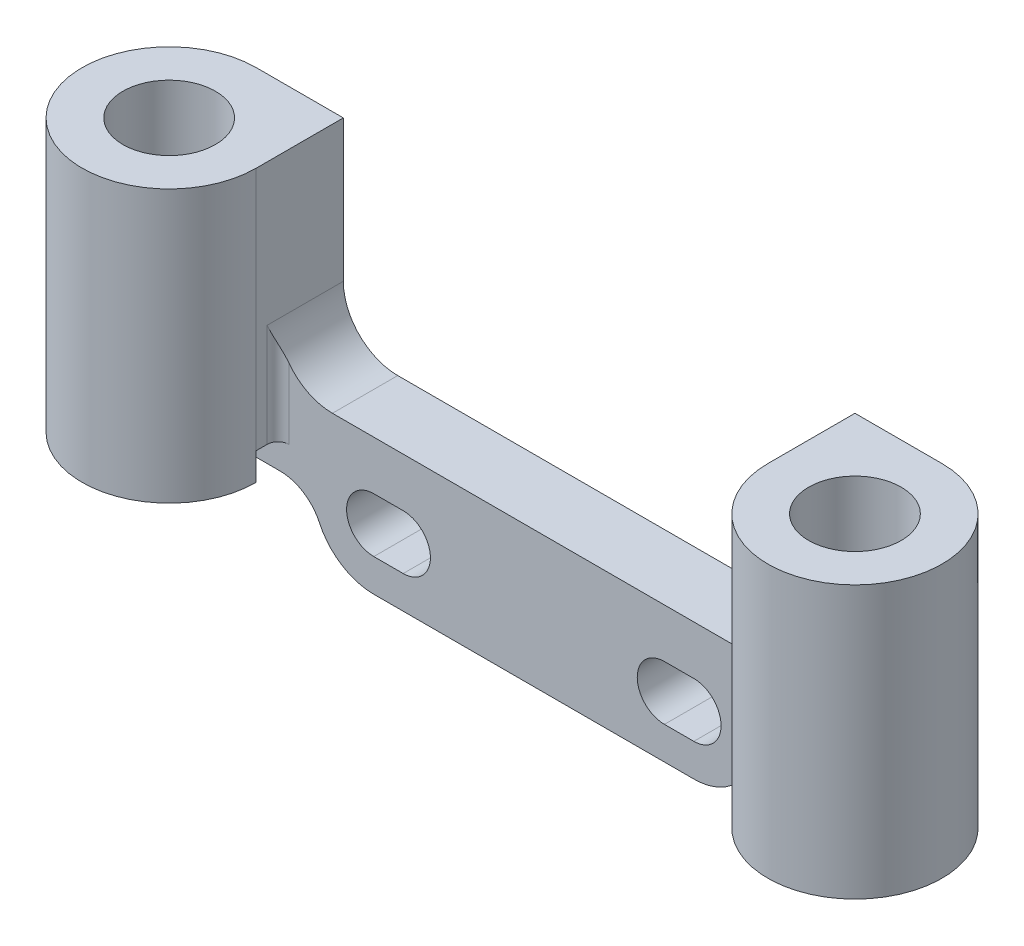
from build123d import *

# Parameters (mm, degrees)
SKETCH_5_R               = 4.25
EXTRUDE_5_DEPTH          = 30.5
CUT_EXTRUDE_2_DEPTH      = 63.121976788
CUT_EXTRUDE_5_DEPTH      = 42
CUT_EXTRUDE_5_DEPTH_BACK = 18
SKETCH_9_W               = 2
SKETCH_9_H               = 3


with BuildPart() as part:
    # 草图5 → 凸台-拉伸5 (new body)
    with BuildSketch(Plane(origin=(0, 0, 0), x_dir=(1, 0, 0), z_dir=(0, 1, 0))):
        with BuildLine():
            Line((-19.3, 0), (43.7, 0))
            ThreePointArc((43.7, 0), (49.356854249, -13.656854249), (35.7, -8))
            Line((35.7, -8), (35.7, -7))
            ThreePointArc((35.7, -7), (35.407106781, -6.292893219), (34.7, -6))
            Line((34.7, -6), (-10.3, -6))
            ThreePointArc((-10.3, -6), (-11.007106781, -6.292893219), (-11.3, -7))
            Line((-11.3, -7), (-11.3, -8))
            ThreePointArc((-11.3, -8), (-24.956854249, -13.656854249), (-19.3, 0))
        make_face()
        with Locations(Location((-19.3, -8, 0), (0, 0, 90))):
            Circle(SKETCH_5_R, mode=Mode.SUBTRACT)
        with Locations(Location((43.7, -8, 0), (0, 0, 90))):
            Circle(SKETCH_5_R, mode=Mode.SUBTRACT)
    extrude(amount=EXTRUDE_5_DEPTH)

    # 草图1 → 切除-拉伸2 (cut, through all)
    with BuildSketch(Plane.XY):
        with BuildLine():
            Line((24.2, 3), (26.9, 3))
            ThreePointArc((26.9, 3), (29.4, 5.5), (26.9, 8))
            Line((26.9, 8), (24.2, 8))
            ThreePointArc((24.2, 8), (21.7, 5.5), (24.2, 3))
        make_face()
        with BuildLine():
            Line((-2.5, 8), (0.2, 8))
            ThreePointArc((0.2, 8), (2.7, 5.5), (0.2, 3))
            Line((0.2, 3), (-2.5, 3))
            ThreePointArc((-2.5, 3), (-5, 5.5), (-2.5, 8))
        make_face()
        with BuildLine():
            Line((35.51684397, 5.5), (51.7, 5.5))
            Line((51.7, 5.5), (51.7, 0))
            Line((51.7, 0), (26.9, 0))
            ThreePointArc((26.9, 0), (29.859151728, 0.863900233), (31.88869914, 3.184210526))
            ThreePointArc((31.88869914, 3.184210526), (33.364733622, 4.871708922), (35.51684397, 5.5))
        make_face()
        with BuildLine():
            Line((-27.3, 5.5), (-11.11684397, 5.5))
            ThreePointArc((-11.11684397, 5.5), (-8.964733622, 4.871708922), (-7.48869914, 3.184210526))
            ThreePointArc((-7.48869914, 3.184210526), (-5.459151728, 0.863900233), (-2.5, 0))
            Line((-2.5, 0), (-27.3, 0))
            Line((-27.3, 0), (-27.3, 5.5))
        make_face()
        with BuildLine():
            Line((-11.3, 30.5), (-11.3, 17.5))
            ThreePointArc((-11.3, 17.5), (-9.835533906, 13.964466094), (-6.3, 12.5))
            Line((-6.3, 12.5), (30.7, 12.5))
            ThreePointArc((30.7, 12.5), (34.235533906, 13.964466094), (35.7, 17.5))
            Line((35.7, 17.5), (35.7, 30.5))
            Line((35.7, 30.5), (-11.3, 30.5))
        make_face()
    extrude(amount=CUT_EXTRUDE_2_DEPTH, mode=Mode.SUBTRACT)

    # 草图9 → 切除-拉伸5 (cut, two sides: drawn at the far end of the back side and taken through both)
    with BuildSketch(Plane(origin=(0, 0, 0), x_dir=(0, 0, -1), z_dir=(1, 0, 0)).offset(-CUT_EXTRUDE_5_DEPTH_BACK)):
        with Locations((-7, 6.523868095)):
            Rectangle(SKETCH_9_W, SKETCH_9_H)
    extrude(amount=CUT_EXTRUDE_5_DEPTH + CUT_EXTRUDE_5_DEPTH_BACK, mode=Mode.SUBTRACT)


solid = part.part
